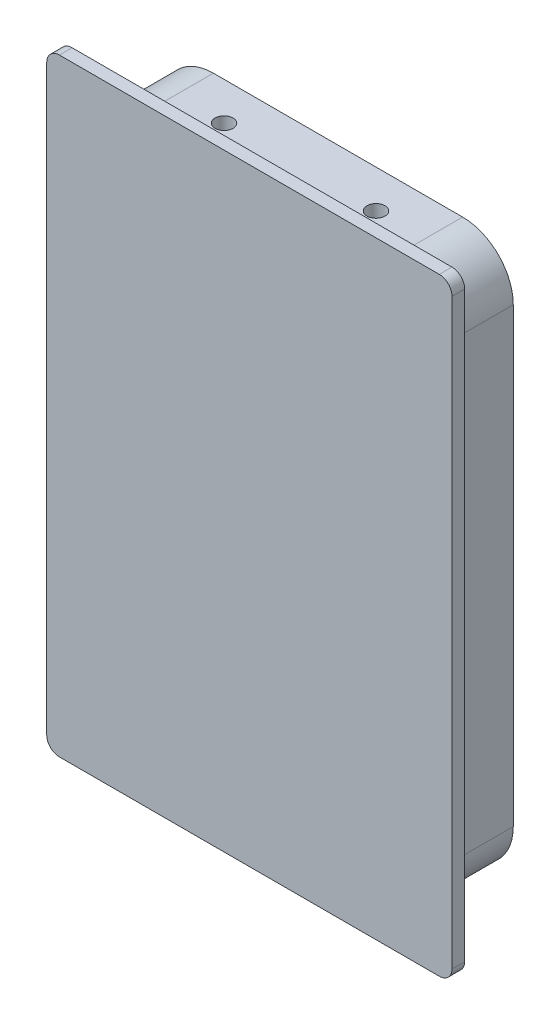
from build123d import *

# Parameters (mm, degrees)
SKETCH1_W                  = 50.8
SKETCH1_H                  = 76.2
BOSS_EXTRUDE1_DEPTH        = 1.5875
SKETCH2_W                  = 43.942
SKETCH2_H                  = 69.342
BOSS_EXTRUDE2_DEPTH        = 9.525
FILLET1_R                  = 6.35
CUT_EXTRUDE1_DEPTH         = 9.525
F_4_40_TAPPED_HOLE1_REACH  = 79.663
F_4_40_TAPPED_HOLE1_BORE_R = 1.1303
FILLET2_R                  = 1.5875


with BuildPart() as part:
    # Sketch1 → Boss-Extrude1 (new body)
    with BuildSketch(Plane.XY):
        Rectangle(SKETCH1_W, SKETCH1_H)
    extrude(amount=BOSS_EXTRUDE1_DEPTH)

    # Sketch2 → Boss-Extrude2 (add)
    with BuildSketch(Plane(origin=(0, 0, 0), x_dir=(-1, 0, 0), z_dir=(0, 0, -1))):
        Rectangle(SKETCH2_W, SKETCH2_H)
    extrude(amount=BOSS_EXTRUDE2_DEPTH)

    # Fillet1
    fillet1_edges = [part.edges().sort_by_distance(p)[0] for p in [
        (-21.971, -34.671, -4.7625),
        (-21.971, 34.671, -4.7625),
        (21.971, 34.671, -4.7625),
        (21.971, -34.671, -4.7625),
    ]]
    fillet(fillet1_edges, radius=FILLET1_R)

    # Sketch3 → Cut-Extrude1 (cut)
    with BuildSketch(Plane(origin=(0, 0, -9.525), x_dir=(-1, 0, 0), z_dir=(0, 0, -1))):
        with BuildLine():
            Line((-18.796, 28.321), (-18.796, -28.321))
            ThreePointArc((-18.796, -28.321), (-17.86606403, -30.56606403), (-15.621, -31.496))
            Line((-15.621, -31.496), (15.621, -31.496))
            ThreePointArc((15.621, -31.496), (17.86606403, -30.56606403), (18.796, -28.321))
            Line((18.796, -28.321), (18.796, 28.321))
            ThreePointArc((18.796, 28.321), (17.86606403, 30.56606403), (15.621, 31.496))
            Line((15.621, 31.496), (-15.621, 31.496))
            ThreePointArc((-15.621, 31.496), (-17.86606403, 30.56606403), (-18.796, 28.321))
        make_face()
    extrude(amount=-CUT_EXTRUDE1_DEPTH, mode=Mode.SUBTRACT)

    # #4-40 Tapped Hole1 bore → #4-40 Tapped Hole1 (cut, up to next)
    with BuildSketch(Plane(origin=(0, 34.671, 0), x_dir=(-1, 0, 0), z_dir=(0, 1, 0)), mode=Mode.PRIVATE) as f_4_40_tapped_hole1_sk1:
        with Locations((-9.525, -4.7625)):
            Circle(F_4_40_TAPPED_HOLE1_BORE_R)
    f_4_40_tapped_hole1_tool1 = extrude(f_4_40_tapped_hole1_sk1.sketch, amount=-F_4_40_TAPPED_HOLE1_REACH, mode=Mode.PRIVATE) & part.part
    # #4-40 Tapped Hole1 bore → #4-40 Tapped Hole1 (cut, up to next)
    with BuildSketch(Plane(origin=(0, 34.671, 0), x_dir=(-1, 0, 0), z_dir=(0, 1, 0)), mode=Mode.PRIVATE) as f_4_40_tapped_hole1_sk2:
        with Locations((9.525, -4.7625)):
            Circle(F_4_40_TAPPED_HOLE1_BORE_R)
    f_4_40_tapped_hole1_tool2 = extrude(f_4_40_tapped_hole1_sk2.sketch, amount=-F_4_40_TAPPED_HOLE1_REACH, mode=Mode.PRIVATE) & part.part
    f_4_40_tapped_hole1_1 = f_4_40_tapped_hole1_tool1.solids().sort_by_distance((9.525, 34.671, -4.7625))[0]
    add(f_4_40_tapped_hole1_1, mode=Mode.SUBTRACT)
    f_4_40_tapped_hole1_2 = f_4_40_tapped_hole1_tool2.solids().sort_by_distance((-9.525, 34.671, -4.7625))[0]
    add(f_4_40_tapped_hole1_2, mode=Mode.SUBTRACT)
    f_4_40_tapped_hole1 = f_4_40_tapped_hole1_1 + f_4_40_tapped_hole1_2  # #4-40 Tapped Hole1 as one shape, for the pattern or mirror that repeats it

    # Mirror1: #4-40 Tapped Hole1 across plane
    add(f_4_40_tapped_hole1.mirror(Plane.ZX), mode=Mode.SUBTRACT)

    # Fillet2
    fillet2_edges = [part.edges().sort_by_distance(p)[0] for p in [
        (25.4, -38.1, 0.79375),
        (-25.4, -38.1, 0.79375),
        (-25.4, 38.1, 0.79375),
        (25.4, 38.1, 0.79375),
    ]]
    fillet(fillet2_edges, radius=FILLET2_R)


solid = part.part
